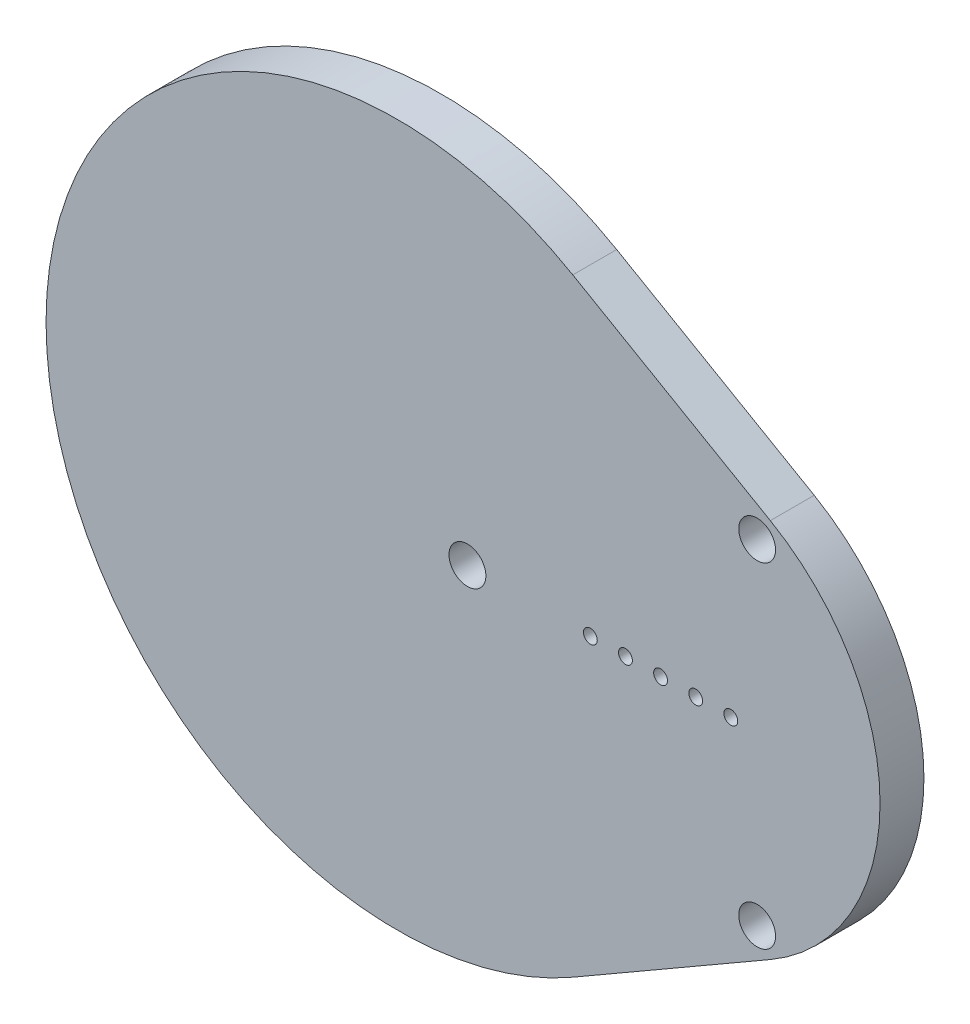
from build123d import *

# Parameters (mm, degrees)
SKETCH1_R           = 2.665
SKETCH1_R_2         = 1
BOSS_EXTRUDE1_DEPTH = 6.35


with BuildPart() as part:
    # Sketch1 → Boss-Extrude1 (new body)
    with BuildSketch(Plane.XY):
        with BuildLine():
            ThreePointArc((-12.7, 43.994090512), (-88.9, 0), (-12.7, -43.994090512))
            Line((-12.7, -43.994090512), (15.875, -27.49630657))
            ThreePointArc((15.875, -27.49630657), (31.75, 0), (15.875, 27.49630657))
            Line((15.875, 27.49630657), (-12.7, 43.994090512))
        make_face()
        with Locations((13.97, -24.196749782)):
            Circle(SKETCH1_R, mode=Mode.SUBTRACT)
        with Locations((13.97, 24.196749782)):
            Circle(SKETCH1_R, mode=Mode.SUBTRACT)
        with Locations((5.08, 0)):
            Circle(SKETCH1_R_2, mode=Mode.SUBTRACT)
        with Locations((10.16, 0)):
            Circle(SKETCH1_R_2, mode=Mode.SUBTRACT)
        Circle(SKETCH1_R_2, mode=Mode.SUBTRACT)
        with Locations((-27.94, 0)):
            Circle(SKETCH1_R, mode=Mode.SUBTRACT)
        with Locations((-10.16, 0)):
            Circle(SKETCH1_R_2, mode=Mode.SUBTRACT)
        with Locations((-5.08, 0)):
            Circle(SKETCH1_R_2, mode=Mode.SUBTRACT)
    extrude(amount=BOSS_EXTRUDE1_DEPTH)


solid = part.part
